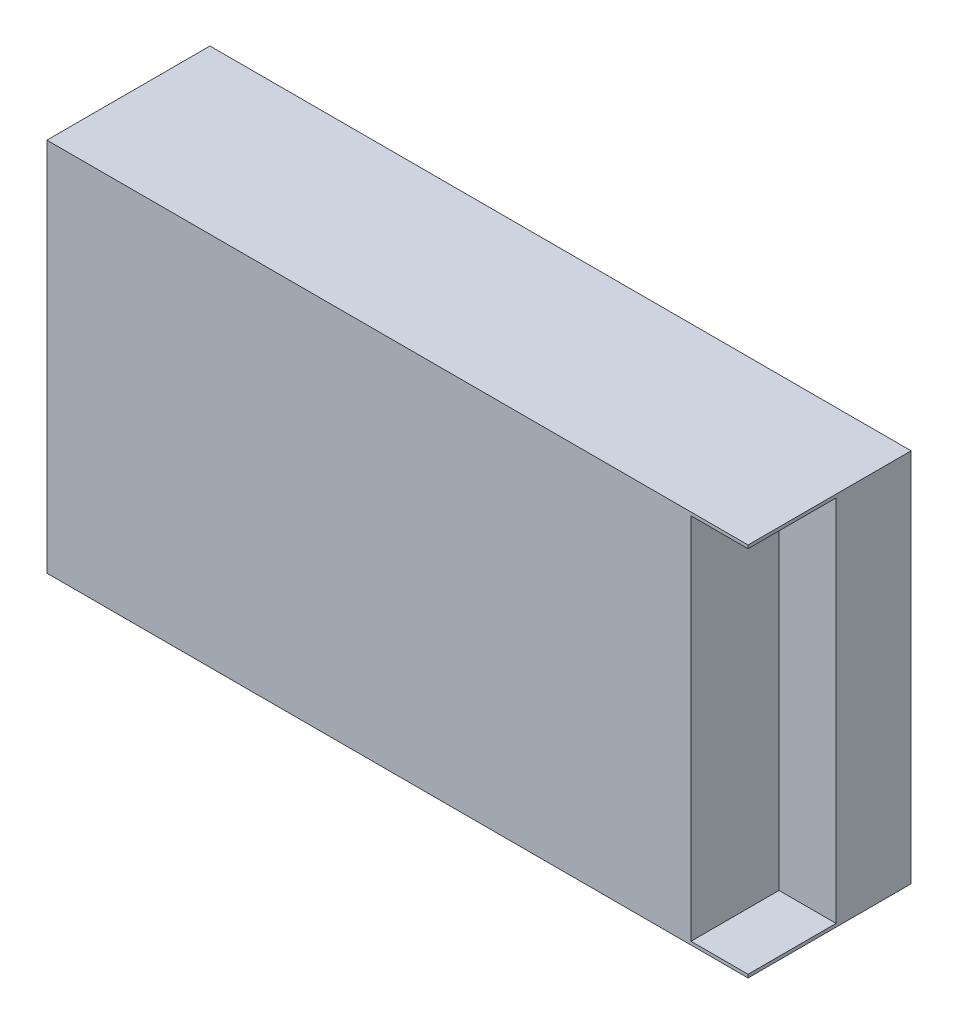
from build123d import *

# Parameters (mm, degrees)
SKETCH1_W           = 215
SKETCH1_H           = 115
BOSS_EXTRUDE1_DEPTH = 50
SKETCH2_W           = 17.5
SKETCH2_H           = 113
CUT_EXTRUDE1_DEPTH  = 27


with BuildPart() as part:
    # Sketch1 → Boss-Extrude1 (new body)
    with BuildSketch(Plane.XY):
        with Locations((107.5, 57.5)):
            Rectangle(SKETCH1_W, SKETCH1_H)
    extrude(amount=BOSS_EXTRUDE1_DEPTH)

    # Sketch2 → Cut-Extrude1 (cut)
    with BuildSketch(Plane.XY.offset(50)):
        with Locations((206.25, 57.5)):
            Rectangle(SKETCH2_W, SKETCH2_H)
    extrude(amount=-CUT_EXTRUDE1_DEPTH, mode=Mode.SUBTRACT)


solid = part.part
